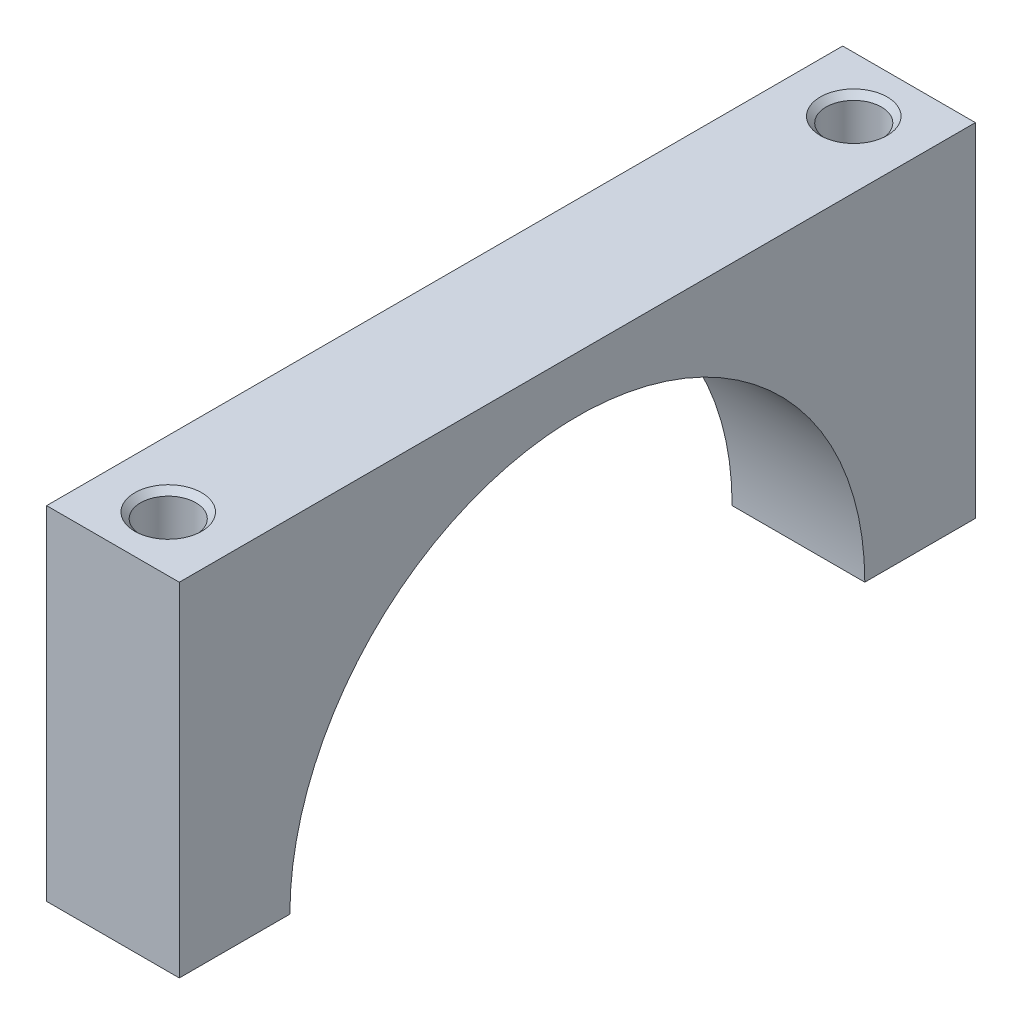
from build123d import *

# Parameters (mm, degrees)
BOSS_EXTRUDE1_DEPTH         = 6
M6_TAPPED_HOLE1_D           = 5
M6_TAPPED_HOLE1_CSINK_D     = 6.05
M6_TAPPED_HOLE1_CSINK_ANGLE = 90


with BuildPart() as part:
    # Sketch1 → Boss-Extrude1 (new, symmetric)
    with BuildSketch(Plane(origin=(0, 0, 0), x_dir=(0, 0, -1), z_dir=(1, 0, 0))):
        with BuildLine():
            Line((-36, 0), (36, 0))
            Line((36, 0), (36, -31))
            Line((36, -31), (26, -31))
            ThreePointArc((26, -31), (0, -5), (-26, -31))
            Line((-26, -31), (-36, -31))
            Line((-36, -31), (-36, 0))
        make_face()
    extrude(amount=BOSS_EXTRUDE1_DEPTH, both=True)

    # M6 Tapped Hole1 (through all)
    with Locations(Plane(origin=(0, 0, 0), x_dir=(1, 0, 0), z_dir=(0, 1, 0))):
        with Locations((0, -31), (0, 31)):
            CounterSinkHole(M6_TAPPED_HOLE1_D / 2, M6_TAPPED_HOLE1_CSINK_D / 2, counter_sink_angle=M6_TAPPED_HOLE1_CSINK_ANGLE)


solid = part.part
